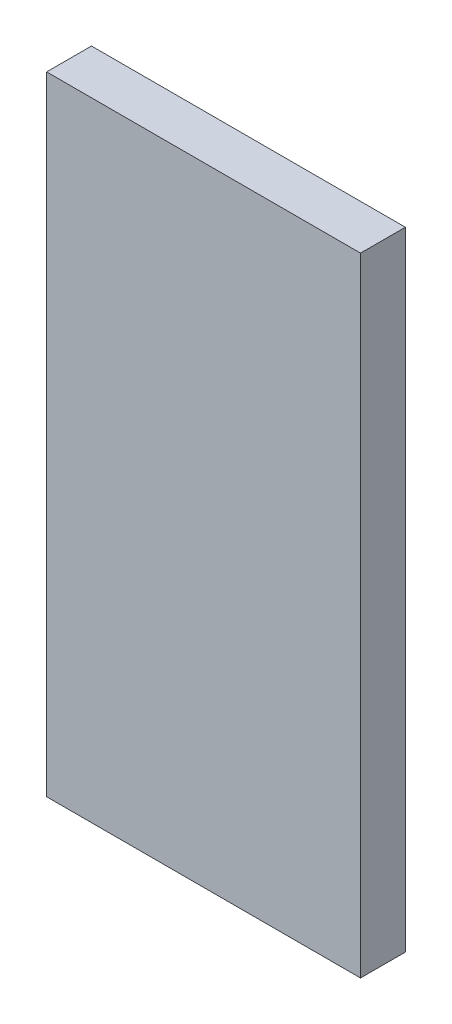
from build123d import *

# Parameters (mm, degrees)
SKETCH_1_W      = 42
SKETCH_1_H      = 42
EXTRUDE_1_DEPTH = 6


with BuildPart() as part:
    # 草图1 → 凸台-拉伸1 (new body)
    with BuildSketch(Plane.XY):
        with Locations((0, 42)):
            Rectangle(SKETCH_1_W, SKETCH_1_H)
        Rectangle(SKETCH_1_W, SKETCH_1_H)
    extrude(amount=EXTRUDE_1_DEPTH)


solid = part.part
